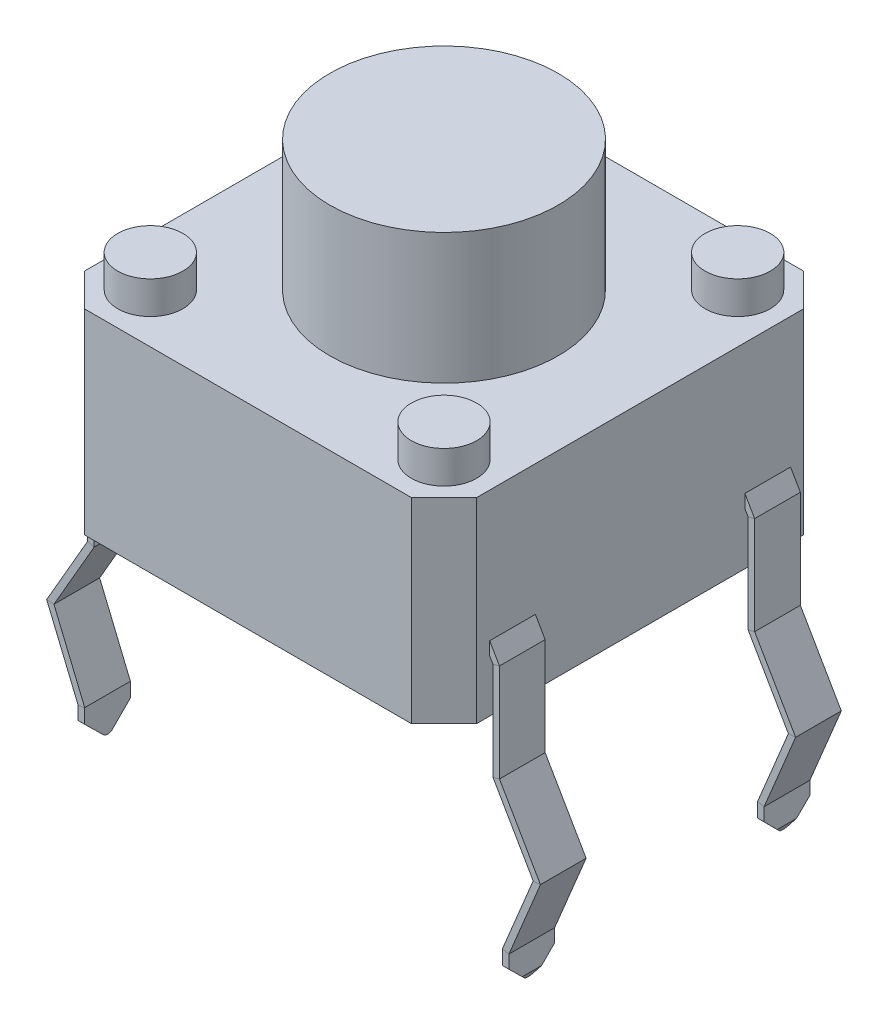
from build123d import *

# Parameters (mm, degrees)
SKETCH1_W               = 6.01
SKETCH1_H               = 6.01
BOSS_EXTRUDE1_DEPTH     = 3
CHAMFER1_SIZE           = 0.5
SKETCH3_R               = 1.75
BOSS_EXTRUDE2_DEPTH     = 2
SKETCH4_R               = 0.5
BOSS_EXTRUDE6_DEPTH     = 0.5
SKETCH5_R               = 0.5
BOSS_EXTRUDE7_DEPTH     = 0.5
SKETCH6_W               = 0.7
SKETCH6_H               = 0.2
MIRROR2_COPY_1_SKETCH_W = 0.7
MIRROR2_COPY_1_SKETCH_H = 0.2
CUT_EXTRUDE1_DEPTH      = 7.95266822


with BuildPart() as part:
    # Sketch1 → Boss-Extrude1 (new body)
    with BuildSketch(Plane(origin=(0, 0, 0), x_dir=(1, 0, 0), z_dir=(0, 1, 0))):
        Rectangle(SKETCH1_W, SKETCH1_H)
    extrude(amount=BOSS_EXTRUDE1_DEPTH)

    # Chamfer1
    chamfer1_edges = [part.edges().sort_by_distance(p)[0] for p in [
        (3.005, 1.5, 3.005),
        (-3.005, 1.5, 3.005),
        (-3.005, 1.5, -3.005),
        (3.005, 1.5, -3.005),
    ]]
    chamfer(chamfer1_edges, length=CHAMFER1_SIZE)

    # Sketch3 → Boss-Extrude2 (add)
    with BuildSketch(Plane(origin=(0, 3, 0), x_dir=(1, 0, 0), z_dir=(0, 1, 0))):
        with Locations(Location((0, 0, 0), (0, 0, 90))):
            Circle(SKETCH3_R)
    extrude(amount=BOSS_EXTRUDE2_DEPTH)

    # Sketch4 → Boss-Extrude6 (add)
    with BuildSketch(Plane(origin=(0, 3, 0), x_dir=(1, 0, 0), z_dir=(0, 1, 0))):
        with Locations(Location((2.25, 2.25, 0), (0, 0, 90))):
            Circle(SKETCH4_R)
        with Locations(Location((2.25, -2.25, 0), (0, 0, 90))):
            Circle(SKETCH4_R)
        with Locations(Location((-2.25, 2.25, 0), (0, 0, 90))):
            Circle(SKETCH4_R)
    extrude(amount=BOSS_EXTRUDE6_DEPTH)

    # Sketch5 → Boss-Extrude7 (add)
    with BuildSketch(Plane(origin=(0, 3, 0), x_dir=(1, 0, 0), z_dir=(0, 1, 0))):
        with Locations(Location((-2.25, -2.25, 0), (0, 0, 90))):
            Circle(SKETCH5_R)
    extrude(amount=BOSS_EXTRUDE7_DEPTH)

    # Sweep1: sweep along a path in Sketch7
    with BuildLine(Plane.XY) as sweep1_path:
        Line((-3.005, 0.9), (-3.105, 0.726794919))
        Line((-3.105, 0.726794919), (-3.105, -0.773205081))
        Line((-3.105, -0.773205081), (-3.72715614, -1.850811126))
        Line((-3.72715614, -1.850811126), (-3.25, -3))
        Line((-3.25, -3), (-3.25, -3.5))
    # Sketch6 → Sweep1 (sweep)
    with BuildSketch(Plane.ZY.offset(3.005)):
        with Locations((-1.955, 0.9)):
            Rectangle(SKETCH6_W, SKETCH6_H)
    sweep1 = sweep(path=sweep1_path.line, transition=Transition.RIGHT)

    # Mirror1: Sweep1 across plane
    add(sweep1.mirror(Plane.XY))

    # Mirror2: Sweep1 across plane
    add(sweep1.mirror(Plane(origin=(0, 0, 0), x_dir=(0, 0, 1), z_dir=(1, 0, 0))))

    # Mirror2 copy 1: sweep along a path in Mirror2 copy 1 path
    with BuildLine(Plane(origin=(0, 0, 0), x_dir=(-1, 0, 0), z_dir=(0, 0, -1))) as mirror2_copy_1_path:
        Line((-3.005, 0.9), (-3.105, 0.726794919))
        Line((-3.105, 0.726794919), (-3.105, -0.773205081))
        Line((-3.105, -0.773205081), (-3.72715614, -1.850811126))
        Line((-3.72715614, -1.850811126), (-3.25, -3))
        Line((-3.25, -3), (-3.25, -3.5))
    # Mirror2 copy 1 sketch → Mirror2 copy 1 (sweep)
    with BuildSketch(Plane(origin=(3.005, 0, 0), x_dir=(0, 0, -1), z_dir=(1, 0, 0))):
        with Locations((-1.955, 0.9)):
            Rectangle(MIRROR2_COPY_1_SKETCH_W, MIRROR2_COPY_1_SKETCH_H)
    sweep(path=mirror2_copy_1_path.line, transition=Transition.RIGHT)

    # Sketch8 → Cut-Extrude1 (cut, symmetric)
    with BuildSketch(Plane(origin=(0, 0, 0), x_dir=(0, 0, -1), z_dir=(1, 0, 0))):
        with BuildLine():
            Line((-2.305, -3.211682602), (-2.305, -3.58660254))
            Line((-2.305, -3.58660254), (-1.605, -3.58660254))
            Line((-1.605, -3.58660254), (-1.605, -3.211682602))
            Line((-1.605, -3.211682602), (-1.881694927, -3.48928466))
            ThreePointArc((-1.881694927, -3.48928466), (-1.952077784, -3.518688814), (-2.022718654, -3.489910032))
            Line((-2.022718654, -3.489910032), (-2.305, -3.211682602))
        make_face()
    cut_extrude1 = extrude(amount=CUT_EXTRUDE1_DEPTH, both=True, mode=Mode.SUBTRACT)

    # Mirror3: Cut-Extrude1 across plane
    add(cut_extrude1.mirror(Plane.XY), mode=Mode.SUBTRACT)


solid = part.part
